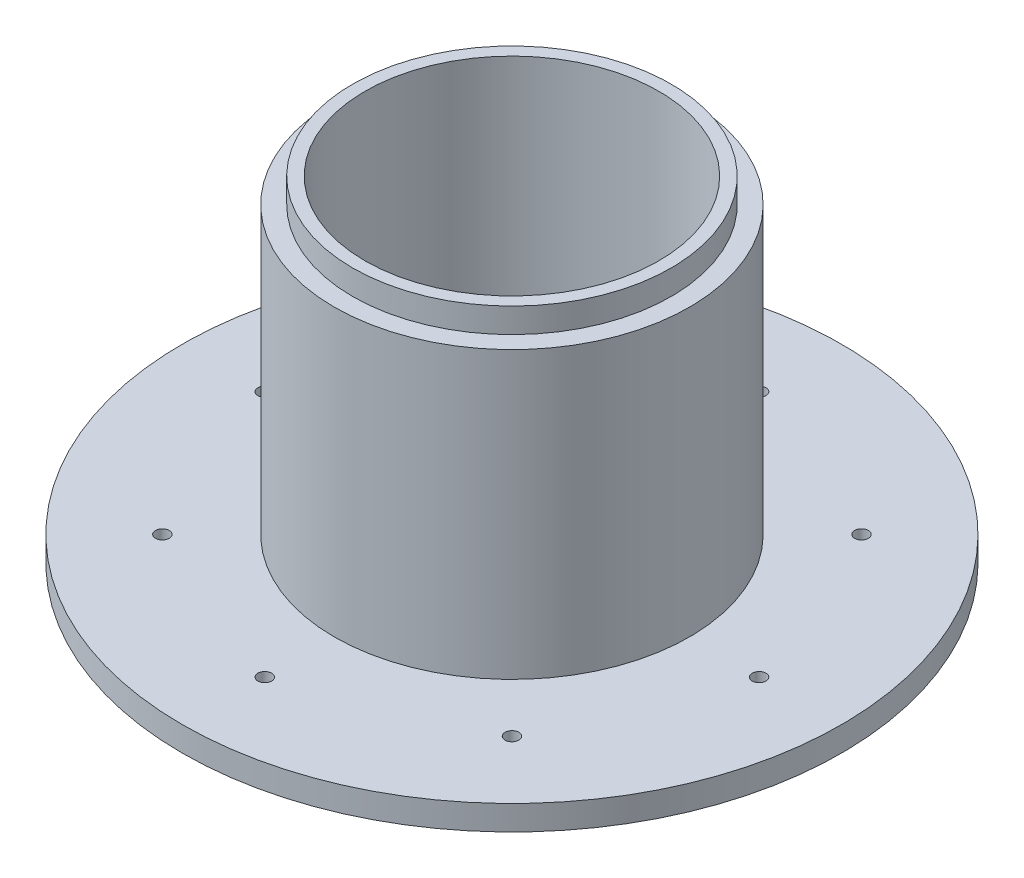
from build123d import *

# Parameters (mm, degrees)
SKETCH1_R               = 60
BOSS_EXTRUDE1_DEPTH     = 4.5
SKETCH2_R               = 29.275
BOSS_EXTRUDE2_DEPTH     = 56.5
CUT_EXTRUDE1_DEPTH      = 105.503588455
CUT_EXTRUDE1_DEPTH_BACK = 105.503588455
SKETCH3_R               = 26.75
SKETCH4_R               = 32.341067561
SKETCH4_R_2             = 29.275
BOSS_EXTRUDE3_DEPTH     = 56.5
CUT_EXTRUDE2_START      = -4.5
SKETCH5_R               = 32.341067561
SKETCH5_R_2             = 29
CUT_EXTRUDE2_DEPTH      = 4.5
CUT_EXTRUDE3_DEPTH      = 105.503588455
CUT_EXTRUDE3_DEPTH_BACK = 105.503588455
SKETCH6_R               = 1.25


with BuildPart() as part:
    # Sketch1 → Boss-Extrude1 (new body)
    with BuildSketch(Plane(origin=(0, 0, 0), x_dir=(1, 0, 0), z_dir=(0, 1, 0))):
        with Locations(Location((0, 0, 0), (0, 0, 270))):
            Circle(SKETCH1_R)
    extrude(amount=BOSS_EXTRUDE1_DEPTH)

    # Sketch2 → Boss-Extrude2 (add)
    with BuildSketch(Plane(origin=(0, 4.5, 0), x_dir=(1, 0, 0), z_dir=(0, 1, 0))):
        with Locations(Location((0, 0, 0), (0, 0, 270))):
            Circle(SKETCH2_R)
    extrude(amount=BOSS_EXTRUDE2_DEPTH)

    # Sketch3 → Cut-Extrude1 (cut, two sides: drawn at the far end of the back side and taken through both)
    with BuildSketch(Plane(origin=(0, 61, 0), x_dir=(1, 0, 0), z_dir=(0, 1, 0)).offset(-CUT_EXTRUDE1_DEPTH_BACK)):
        with Locations(Location((0, 0, 0), (0, 0, 270))):
            Circle(SKETCH3_R)
    extrude(amount=CUT_EXTRUDE1_DEPTH + CUT_EXTRUDE1_DEPTH_BACK, mode=Mode.SUBTRACT)

    # Sketch4 → Boss-Extrude3 (add)
    with BuildSketch(Plane(origin=(0, 4.5, 0), x_dir=(1, 0, 0), z_dir=(0, 1, 0))):
        with Locations(Location((0, 0, 0), (0, 0, 270))):
            Circle(SKETCH4_R)
        Circle(SKETCH4_R_2, mode=Mode.SUBTRACT)
    extrude(amount=BOSS_EXTRUDE3_DEPTH)

    # Sketch5 → Cut-Extrude2 (cut)
    with BuildSketch(Plane(origin=(0, 61, 0), x_dir=(1, 0, 0), z_dir=(0, 1, 0)).offset(CUT_EXTRUDE2_START)):
        with Locations(Location((0, 0, 0), (0, 0, 270))):
            Circle(SKETCH5_R)
        with Locations(Location((0, 0, 0), (0, 0, 270))):
            Circle(SKETCH5_R_2, mode=Mode.SUBTRACT)
    extrude(amount=CUT_EXTRUDE2_DEPTH, mode=Mode.SUBTRACT)

    # Sketch6 → Cut-Extrude3 (cut, two sides: drawn at the far end of the back side and taken through both)
    with BuildSketch(Plane.XZ.offset(-CUT_EXTRUDE3_DEPTH_BACK)):
        with Locations(Location((31.819805153, -31.819805153, 0), (0, 0, 270))):
            Circle(SKETCH6_R)
        with Locations(Location((0, 45, 0), (0, 0, 270))):
            Circle(SKETCH6_R)
        with Locations(Location((31.819805153, 31.819805153, 0), (0, 0, 270))):
            Circle(SKETCH6_R)
        with Locations(Location((45, 0, 0), (0, 0, 270))):
            Circle(SKETCH6_R)
        with Locations(Location((-31.819805153, 31.819805153, 0), (0, 0, 270))):
            Circle(SKETCH6_R)
        with Locations(Location((-45, 0, 0), (0, 0, 270))):
            Circle(SKETCH6_R)
        with Locations(Location((-31.819805153, -31.819805153, 0), (0, 0, 270))):
            Circle(SKETCH6_R)
        with Locations(Location((0, -45, 0), (0, 0, 270))):
            Circle(SKETCH6_R)
    extrude(amount=CUT_EXTRUDE3_DEPTH + CUT_EXTRUDE3_DEPTH_BACK, mode=Mode.SUBTRACT)


solid = part.part
